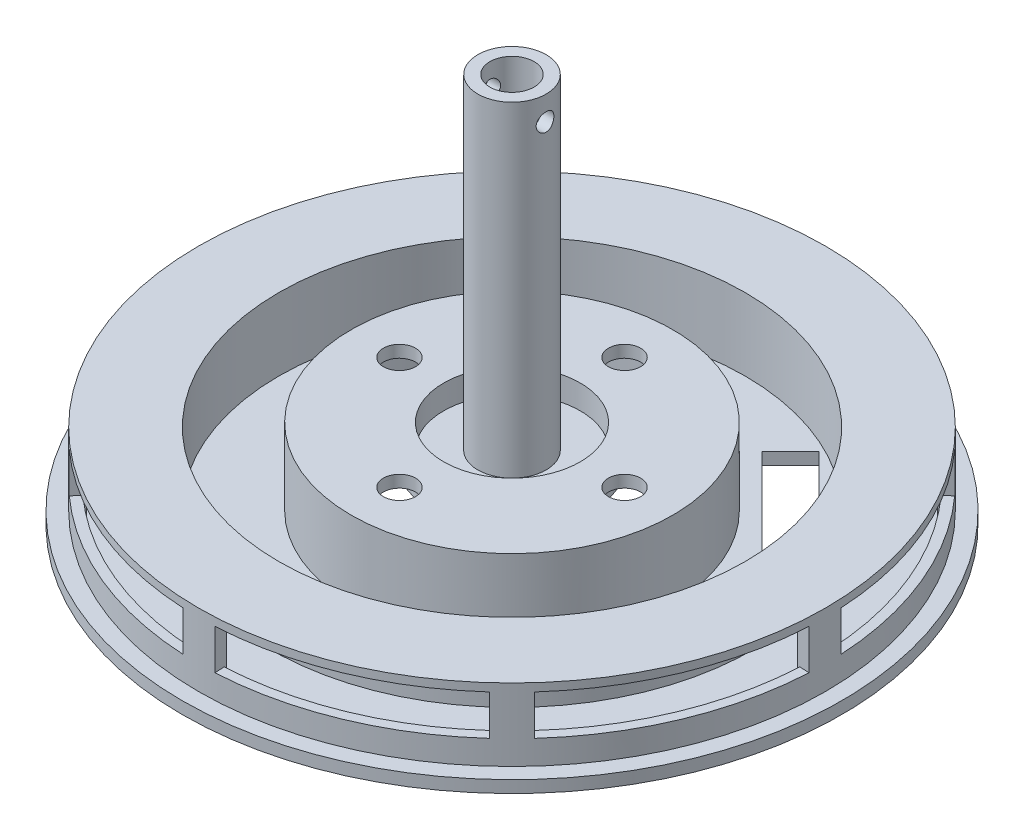
from build123d import *
from build123d.topology import SkipClean

# Parameters (mm, degrees)
SKETCH_1_R                      = 10
SKETCH_1_R_2                    = 2.75
EXTRUDE_1_DEPTH                 = 1.5
SKETCH_2_R                      = 10
SKETCH_2_R_2                    = 8.5
EXTRUDE_2_DEPTH                 = 3
SKETCH_3_R                      = 4.25
SKETCH_3_R_2                    = 2.75
EXTRUDE_3_DEPTH                 = 40.5
EXTRUDE_START                   = -1.5
SKETCH_4_R                      = 20
SKETCH_4_R_2                    = 8.5
SKETCH_4_R_3                    = 2
SKETCH_4_R_4                    = 1.9999999999999996
SKETCH_4_R_5                    = 2.0000000000000013
EXTRUDE_4_DEPTH                 = 1.5
EXTRUDE_START_2                 = 8
SKETCH_5_R                      = 20
SKETCH_5_R_2                    = 18.5
EXTRUDE_5_DEPTH                 = 8
EXTRUDE_START_3                 = 1.5
SKETCH_8_R                      = 41
SKETCH_8_R_2                    = 18.5
SKETCH_8_R_3                    = 0.9000000000000004
SKETCH_8_R_4                    = 0.9000000000000011
EXTRUDE_6_DEPTH                 = 1.5
SKETCH_9_R                      = 30.000000000000004
SKETCH_9_R_2                    = 29
EXTRUDE_7_DEPTH                 = 9
EXTRUDE_START_4                 = -1
SKETCH_10_R                     = 39
SKETCH_10_R_2                   = 29
EXTRUDE_8_DEPTH                 = 1
SKETCH_12_R                     = 39
SKETCH_12_R_2                   = 37.8
EXTRUDE_9_DEPTH                 = 3
EXTRUDE_START_5                 = -9
EXTRUDE_10_DEPTH                = 9
CUT_EXTRUDE_1_REACH             = 73.596
SKETCH_14_R                     = 1.0999999999999972
CUT_EXTRUDE_1_DIRECTION_2_REACH = 73.596


with BuildPart() as part:
    # 草图1 → 凸台-拉伸1 (new body)
    with BuildSketch(Plane(origin=(0, 0, 0), x_dir=(1, 0, 0), z_dir=(0, 1, 0))):
        with Locations(Location((0, 0, 0), (0, 0, 270))):
            Circle(SKETCH_1_R)
        with Locations(Location((0, 0, 0), (0, 0, 270))):
            Circle(SKETCH_1_R_2, mode=Mode.SUBTRACT)
    extrude(amount=EXTRUDE_1_DEPTH)

    # 草图2 → 凸台-拉伸2 (add)
    with BuildSketch(Plane(origin=(0, 1.5, 0), x_dir=(1, 0, 0), z_dir=(0, 1, 0))):
        with Locations(Location((0, 0, 0), (0, 0, 270))):
            Circle(SKETCH_2_R)
        with Locations(Location((0, 0, 0), (0, 0, 270))):
            Circle(SKETCH_2_R_2, mode=Mode.SUBTRACT)
    extrude(amount=EXTRUDE_2_DEPTH)

    # 草图3 → 凸台-拉伸3 (add)
    with BuildSketch(Plane(origin=(0, 1.5, 0), x_dir=(1, 0, 0), z_dir=(0, 1, 0))):
        with Locations(Location((0, 0, 0), (0, 0, 270))):
            Circle(SKETCH_3_R)
        with Locations(Location((0, 0, 0), (0, 0, 270))):
            Circle(SKETCH_3_R_2, mode=Mode.SUBTRACT)
    extrude(amount=EXTRUDE_3_DEPTH)

    # 草图4 → 凸台-拉伸4 (add)
    with BuildSketch(Plane(origin=(0, 4.500000000000001, 0), x_dir=(1, 0, 0), z_dir=(0, 1, 0)).offset(EXTRUDE_START)):
        with Locations(Location((0, 0, 0), (0, 0, 270))):
            Circle(SKETCH_4_R)
        with Locations(Location((0, 0, 0), (0, 0, 270))):
            Circle(SKETCH_4_R_2, mode=Mode.SUBTRACT)
        with Locations(Location((0, -14, 0), (0, 0, 270))):
            Circle(SKETCH_4_R_3, mode=Mode.SUBTRACT)
        with Locations(Location((-14, 0, 0), (0, 0, 270))):
            Circle(SKETCH_4_R_4, mode=Mode.SUBTRACT)
        with Locations(Location((14, 0, 0), (0, 0, 270))):
            Circle(SKETCH_4_R_5, mode=Mode.SUBTRACT)
        with Locations(Location((0, 14, 0), (0, 0, 270))):
            Circle(SKETCH_4_R_3, mode=Mode.SUBTRACT)
    extrude(amount=EXTRUDE_4_DEPTH)

    # 草图5 → 凸台-拉伸5 (add)
    with BuildSketch(Plane.XZ.offset(-3.0000000000000004).offset(EXTRUDE_START_2)):
        with Locations(Location((0, 0, 0), (0, 0, 90))):
            Circle(SKETCH_5_R)
        with Locations(Location((0, 0, 0), (0, 0, 270))):
            Circle(SKETCH_5_R_2, mode=Mode.SUBTRACT)
    extrude(amount=-EXTRUDE_5_DEPTH)

    # 草图8 → 凸台-拉伸6 (add)
    with BuildSketch(Plane.XZ.offset(4.999999999999999).offset(EXTRUDE_START_3)):
        with Locations(Location((0, 0, 0), (0, 0, 270))):
            Circle(SKETCH_8_R)
        with Locations(Location((0, 0, 0), (0, 0, 270))):
            Circle(SKETCH_8_R_2, mode=Mode.SUBTRACT)
        with Locations(Location((24, 0, 0), (0, 0, 270))):
            Circle(SKETCH_8_R_3, mode=Mode.SUBTRACT)
        with Locations(Location((-24, 0, 0), (0, 0, 270))):
            Circle(SKETCH_8_R_3, mode=Mode.SUBTRACT)
        with Locations(Location((0, -24, 0), (0, 0, 270))):
            Circle(SKETCH_8_R_4, mode=Mode.SUBTRACT)
        with Locations(Location((0, 24, 0), (0, 0, 270))):
            Circle(SKETCH_8_R_4, mode=Mode.SUBTRACT)
        Polygon((9.192388155425043, -21.92031021678299), (21.92031021678307, -9.192388155425377), (25.455844122715792, -12.727922061358134), (12.727922061357729, -25.455844122715785), align=None, mode=Mode.SUBTRACT)
    extrude(amount=-EXTRUDE_6_DEPTH)

    # 草图9 → 凸台-拉伸7 (add)
    with BuildSketch(Plane(origin=(0, -4.999999999999999, 0), x_dir=(1, 0, 0), z_dir=(0, 1, 0))):
        with Locations(Location((0, 0, 0), (0, 0, 90))):
            Circle(SKETCH_9_R)
        with Locations(Location((0, 0, 0), (0, 0, 270))):
            Circle(SKETCH_9_R_2, mode=Mode.SUBTRACT)
    extrude(amount=EXTRUDE_7_DEPTH)

    # 草图10 → 凸台-拉伸8 (add)
    with BuildSketch(Plane(origin=(0, 4, 0), x_dir=(1, 0, 0), z_dir=(0, 1, 0)).offset(EXTRUDE_START_4)):
        with Locations(Location((0, 0, 0), (0, 0, 270))):
            Circle(SKETCH_10_R)
        with Locations(Location((0, 0, 0), (0, 0, 270))):
            Circle(SKETCH_10_R_2, mode=Mode.SUBTRACT)
    extrude(amount=EXTRUDE_8_DEPTH)

    # 草图12 → 凸台-拉伸9 (add)
    with BuildSketch(Plane(origin=(0, -4.999999999999999, 0), x_dir=(1, 0, 0), z_dir=(0, 1, 0))):
        with Locations(Location((0, 0, 0), (0, 0, 270))):
            Circle(SKETCH_12_R)
        with Locations(Location((0, 0, 0), (0, 0, 270))):
            Circle(SKETCH_12_R_2, mode=Mode.SUBTRACT)
    extrude(amount=EXTRUDE_9_DEPTH)

    # 草图13 → 凸台-拉伸10 (add)
    with SkipClean():  # the faces are left unmerged after this step: merging them gives an invalid solid
        with BuildSketch(Plane(origin=(0, 4, 0), x_dir=(1, 0, 0), z_dir=(0, 1, 0)).offset(EXTRUDE_START_5)):
            with BuildLine():
                Line((1.923076923076923, 37.45065787336625), (2, 38.948684188300895))
                ThreePointArc((2, 38.948684188300895), (2.39e-15, 39), (-2, 38.948684188300895))
                Line((-2, 38.948684188300895), (-1.923076923076923, 37.45065787336625))
                ThreePointArc((-1.923076923076923, 37.45065787336625), (2.3e-15, 37.5), (1.923076923076923, 37.45065787336625))
            make_face()
            with BuildLine():
                Line((25.12179340910359, 27.8414348752057), (26.12666514546773, 28.955092270213918))
                ThreePointArc((26.12666514546773, 28.955092270213918), (27.577164466275356, 27.577164466275352), (28.955092270213918, 26.12666514546773))
                Line((28.955092270213918, 26.12666514546773), (27.841434875205692, 25.12179340910359))
                ThreePointArc((27.841434875205692, 25.12179340910359), (26.516504294495533, 26.51650429449554), (25.12179340910359, 27.8414348752057))
            make_face()
            with BuildLine():
                Line((37.45065787336625, 1.9230769230769253), (38.948684188300895, 2.0000000000000027))
                ThreePointArc((38.948684188300895, 2.0000000000000027), (39, 2.71e-15), (38.948684188300895, -1.9999999999999973))
                Line((38.948684188300895, -1.9999999999999973), (37.45065787336625, -1.923076923076921))
                ThreePointArc((37.45065787336625, -1.923076923076921), (37.5, 2.08e-15), (37.45065787336625, 1.9230769230769253))
            make_face()
            with BuildLine():
                Line((27.8414348752057, -25.12179340910359), (28.955092270213918, -26.126665145467726))
                ThreePointArc((28.955092270213918, -26.126665145467726), (27.577164466275356, -27.577164466275352), (26.12666514546773, -28.955092270213914))
                Line((26.12666514546773, -28.955092270213914), (25.12179340910359, -27.841434875205692))
                ThreePointArc((25.12179340910359, -27.841434875205692), (26.51650429449554, -26.516504294495533), (27.8414348752057, -25.12179340910359))
            make_face()
            with BuildLine():
                Line((1.9230769230769276, -37.45065787336625), (2.0000000000000044, -38.948684188300895))
                ThreePointArc((2.0000000000000044, -38.948684188300895), (2.39e-15, -39), (-1.9999999999999958, -38.948684188300895))
                Line((-1.9999999999999958, -38.948684188300895), (-1.9230769230769182, -37.45065787336625))
                ThreePointArc((-1.9230769230769182, -37.45065787336625), (2.3e-15, -37.5), (1.9230769230769276, -37.45065787336625))
            make_face()
            with BuildLine():
                Line((-25.12179340910359, -27.841434875205703), (-26.126665145467726, -28.95509227021392))
                ThreePointArc((-26.126665145467726, -28.95509227021392), (-27.577164466275352, -27.577164466275356), (-28.955092270213914, -26.126665145467733))
                Line((-28.955092270213914, -26.126665145467733), (-27.841434875205692, -25.121793409103592))
                ThreePointArc((-27.841434875205692, -25.121793409103592), (-26.516504294495533, -26.51650429449554), (-25.12179340910359, -27.841434875205703))
            make_face()
            with BuildLine():
                Line((-37.45065787336625, -1.9230769230769298), (-38.948684188300895, -2.000000000000007))
                ThreePointArc((-38.948684188300895, -2.000000000000007), (-39, -1.254e-14), (-38.948684188300895, 1.9999999999999931))
                Line((-38.948684188300895, 1.9999999999999931), (-37.45065787336625, 1.923076923076916))
                ThreePointArc((-37.45065787336625, 1.923076923076916), (-37.5, -1.206e-14), (-37.45065787336625, -1.9230769230769298))
            make_face()
            with BuildLine():
                Line((-27.841434875205703, 25.12179340910358), (-28.95509227021392, 26.126665145467722))
                ThreePointArc((-28.95509227021392, 26.126665145467722), (-27.577164466275352, 27.577164466275356), (-26.126665145467733, 28.95509227021391))
                Line((-26.126665145467733, 28.95509227021391), (-25.121793409103592, 27.84143487520569))
                ThreePointArc((-25.121793409103592, 27.84143487520569), (-26.516504294495547, 26.516504294495526), (-27.841434875205703, 25.12179340910358))
            make_face()
        extrude(amount=EXTRUDE_10_DEPTH)

    # 草图14 → 切除-拉伸1 (cut, up to next)
    with BuildSketch(Plane(origin=(0, 0, 0), x_dir=(0, 0, -1), z_dir=(1, 0, 0)), mode=Mode.PRIVATE) as cut_extrude_1_sk1:
        with Locations((0, 39)):
            Circle(SKETCH_14_R)
    cut_extrude_1_tool1 = extrude(cut_extrude_1_sk1.sketch, amount=-CUT_EXTRUDE_1_REACH, mode=Mode.PRIVATE) & part.part
    add(cut_extrude_1_tool1.solids().sort_by_distance((0, 39, 0))[0], mode=Mode.SUBTRACT)

    # 草图14 → 切除-拉伸1 direction 2 (cut, up to next)
    with BuildSketch(Plane(origin=(0, 0, 0), x_dir=(0, 0, -1), z_dir=(1, 0, 0)), mode=Mode.PRIVATE) as cut_extrude_1_direction_2_sk1:
        with Locations((0, 39)):
            Circle(SKETCH_14_R)
    cut_extrude_1_direction_2_tool1 = extrude(cut_extrude_1_direction_2_sk1.sketch, amount=CUT_EXTRUDE_1_DIRECTION_2_REACH, mode=Mode.PRIVATE) & part.part
    add(cut_extrude_1_direction_2_tool1.solids().sort_by_distance((0, 39, 0))[0], mode=Mode.SUBTRACT)


solid = part.part
